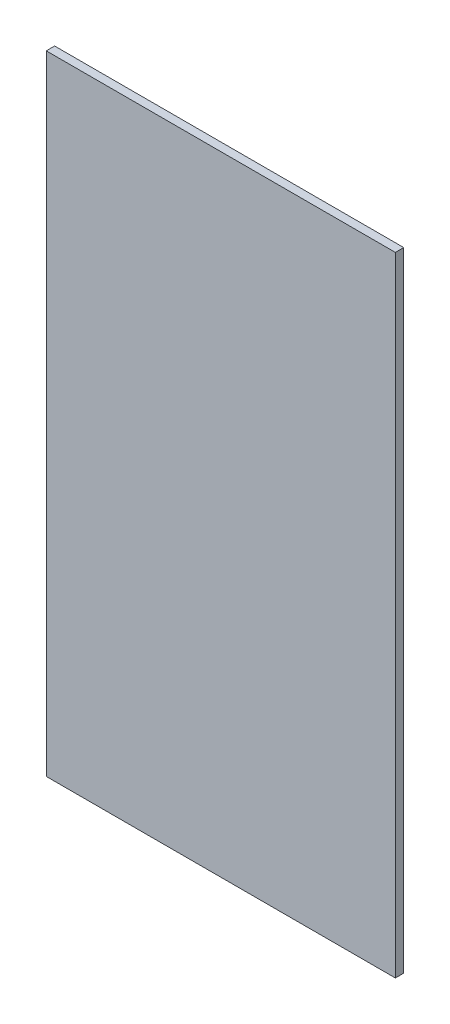
from build123d import *

# Parameters (mm, degrees)
DIMENSIONSSKETCH_W = 250
DIMENSIONSSKETCH_H = 450
DIMENSIONS_DEPTH   = 3


with BuildPart() as part:
    # DimensionsSketch → Dimensions (new, symmetric)
    with BuildSketch(Plane.XY):
        Rectangle(DIMENSIONSSKETCH_W, DIMENSIONSSKETCH_H)
    extrude(amount=DIMENSIONS_DEPTH, both=True)


solid = part.part
